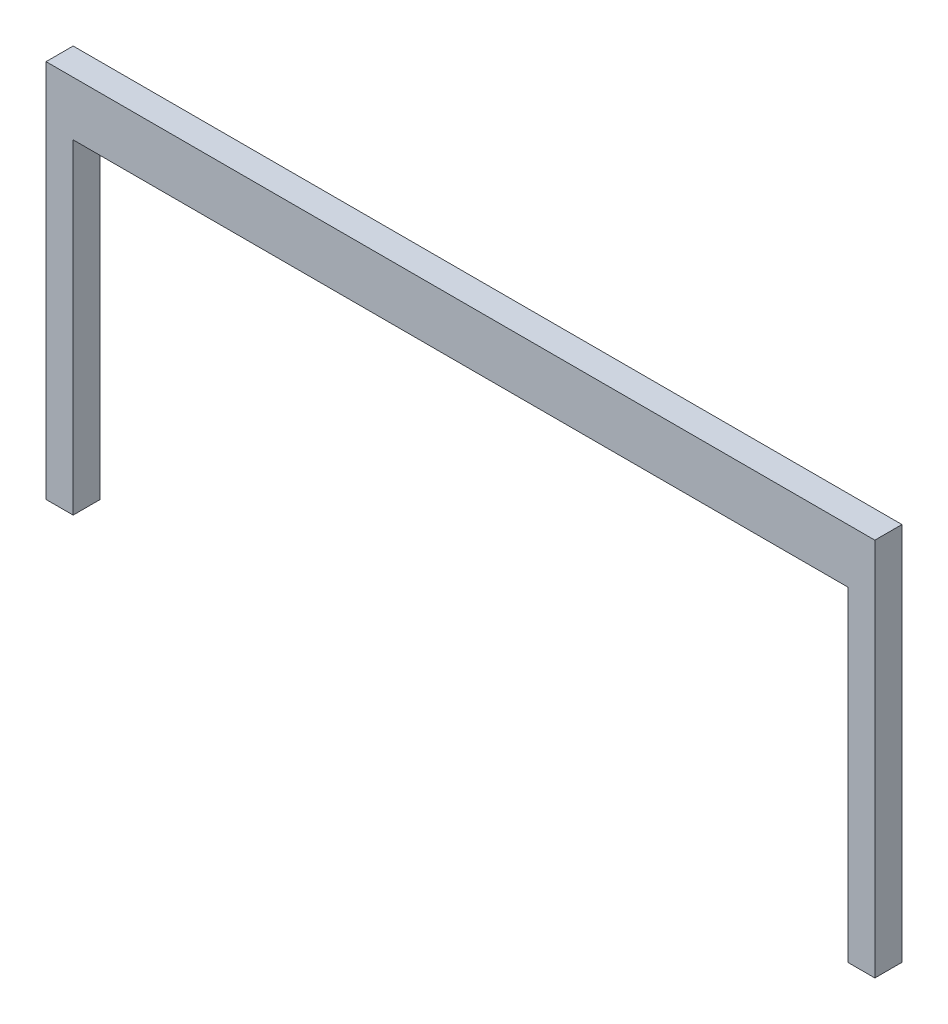
from build123d import *

# Parameters (mm, degrees)
EXTRUDE_1_DEPTH = 5


with BuildPart() as part:
    # 草图1 → 凸台-拉伸1 (new body)
    with BuildSketch(Plane.XY):
        Polygon((71.5, 30.90890961), (-71.5, 30.90890961), (-71.5, -29.09109039), (-76.5, -29.09109039), (-76.5, 40.90890961), (76.5, 40.90890961), (76.5, -29.09109039), (71.5, -29.09109039), align=None)
    extrude(amount=EXTRUDE_1_DEPTH)


solid = part.part
